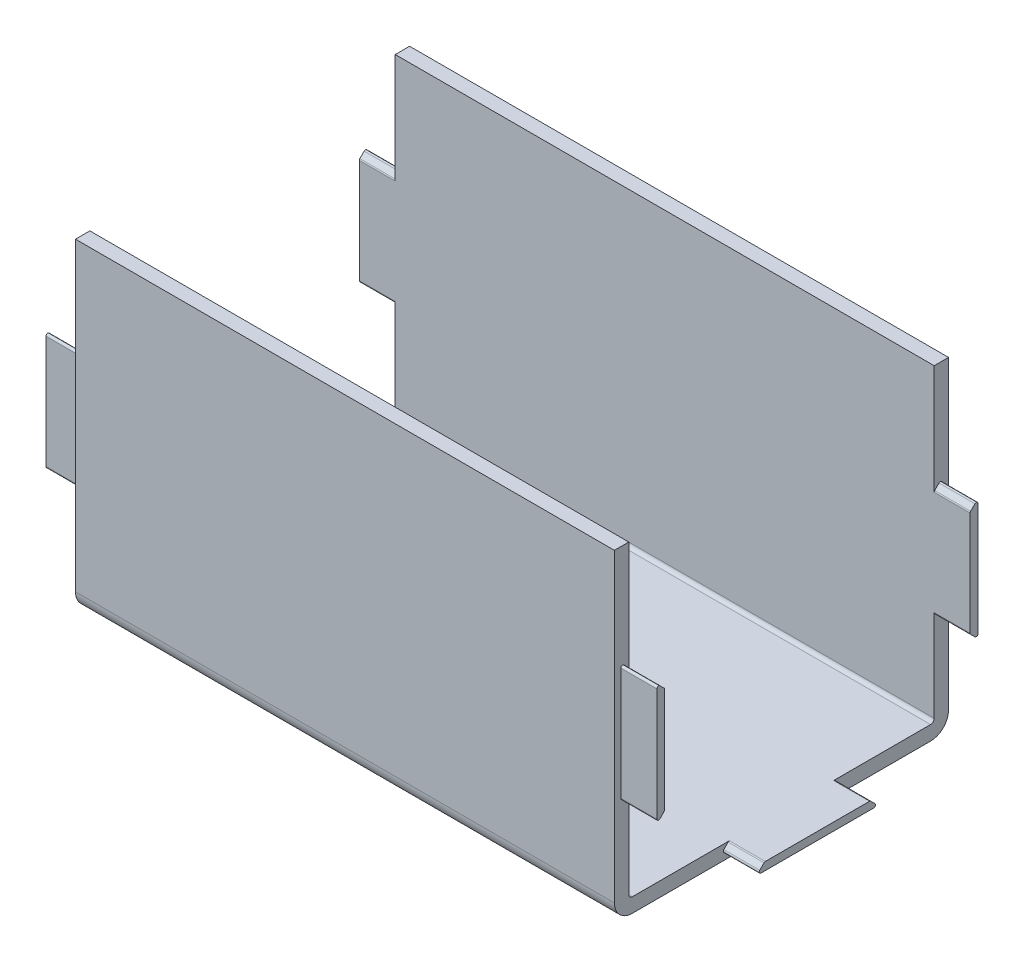
from build123d import *

# Parameters (mm, degrees)
SKETCH_1_W             = 150
SKETCH_1_H             = 93
EXTRUDE_1_DEPTH        = 90
FILLET_1_R             = 5
SHELL_1_T              = -4
EXTRUDE_3_DEPTH        = 10
FILLET_2_R             = 0.5
FILLET_2_OF_MIRROR_1_R = 0.5


with BuildPart() as part:
    # 草圖1 → 填料-伸長1 (new body)
    with BuildSketch(Plane(origin=(0, 0, 0), x_dir=(1, 0, 0), z_dir=(0, 1, 0))):
        Rectangle(SKETCH_1_W, SKETCH_1_H)
    extrude(amount=EXTRUDE_1_DEPTH)

    # 圓角1
    fillet_1_edges = [part.edges().sort_by_distance(p)[0] for p in [
        (0, 0, 46.5),
        (0, 0, -46.5),
    ]]
    fillet(fillet_1_edges, radius=FILLET_1_R)

    # 薄殼1
    shell_1_openings = [part.faces().sort_by_distance(p)[0] for p in [
        (0, 90, 0),
        (-75, 45.056329123, 0),
        (75, 45.056329123, 0),
    ]]
    offset(amount=SHELL_1_T, openings=shell_1_openings, kind=Kind.INTERSECTION)

    # 草圖2 → 填料-伸長3 (add)
    with BuildSketch(Plane(origin=(75, 0, 0), x_dir=(0, 0, -1), z_dir=(1, 0, 0))):
        Polygon((42.5, 59.7), (44.7, 61.9), (44.7, 28.1), (42.5, 30.3), align=None)
        Polygon((14.7, 4), (16.9, 1.8), (-16.9, 1.8), (-14.7, 4), align=None)
        Polygon((-42.5, 59.7), (-42.5, 30.3), (-44.7, 28.1), (-44.7, 61.9), align=None)
    extrude_3 = extrude(amount=EXTRUDE_3_DEPTH)

    # 圓角2
    fillet_2_edges = [part.edges().sort_by_distance(p)[0] for p in [
        (80, 59.7, -42.5),
        (80, 30.3, -42.5),
        (80, 28.1, -44.7),
        (80, 61.9, -44.7),
        (80, 4, -14.7),
        (80, 4, 14.7),
        (80, 1.8, 16.9),
        (80, 1.8, -16.9),
        (80, 61.9, 44.7),
        (80, 28.1, 44.7),
        (80, 30.3, 42.5),
        (80, 59.7, 42.5),
    ]]
    fillet(fillet_2_edges, radius=FILLET_2_R)

    # 鏡射1: 填料-伸長3 across plane
    add(extrude_3.mirror(Plane(origin=(0, 0, 0), x_dir=(0, 0, 1), z_dir=(1, 0, 0))))

    # 圓角2 of 鏡射1
    fillet_2_of_mirror_1_edges = [part.edges().sort_by_distance(p)[0] for p in [
        (-80, 59.7, -42.5),
        (-80, 30.3, -42.5),
        (-80, 28.1, -44.7),
        (-80, 61.9, -44.7),
        (-80, 4, -14.7),
        (-80, 4, 14.7),
        (-80, 1.8, 16.9),
        (-80, 1.8, -16.9),
        (-80, 61.9, 44.7),
        (-80, 28.1, 44.7),
        (-80, 30.3, 42.5),
        (-80, 59.7, 42.5),
    ]]
    fillet(fillet_2_of_mirror_1_edges, radius=FILLET_2_OF_MIRROR_1_R)


solid = part.part
